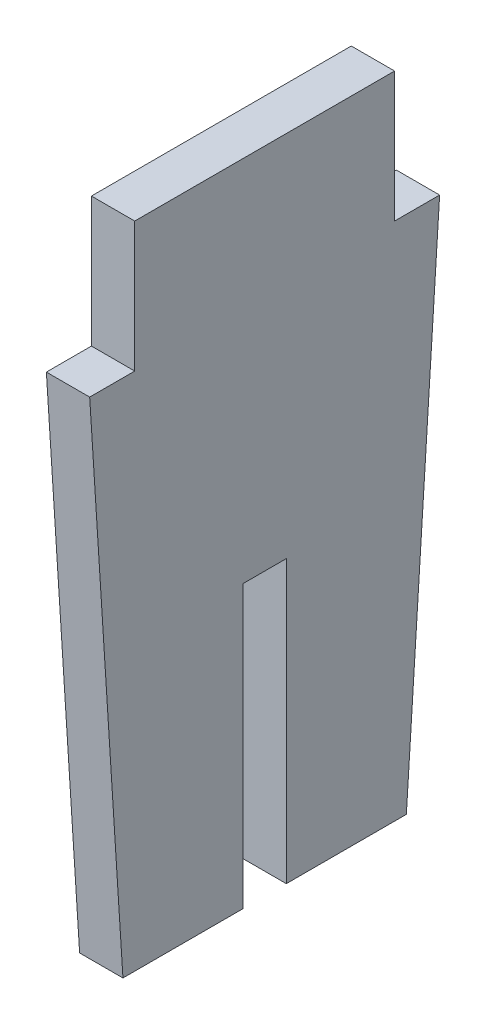
from build123d import *

# Parameters (mm, degrees)
BOSS_EXTRUDE1_DEPTH = 3.175


with BuildPart() as part:
    # Sketch1 → Boss-Extrude1 (new body)
    with BuildSketch(Plane(origin=(0, 0, 0), x_dir=(0, 0, -1), z_dir=(1, 0, 0))):
        Polygon((0, 47.625), (19.05, 47.625), (19.05, 38.1), (22.352, 38.1), (20.32, 6.35), (19.9136, 0), (11.1125, 0), (11.1125, 20.6375), (7.9375, 20.6375), (7.9375, 0), (-0.8636, 0), (-1.27, 6.35), (-3.302, 38.1), (0, 38.1), align=None)
    extrude(amount=BOSS_EXTRUDE1_DEPTH)


solid = part.part
